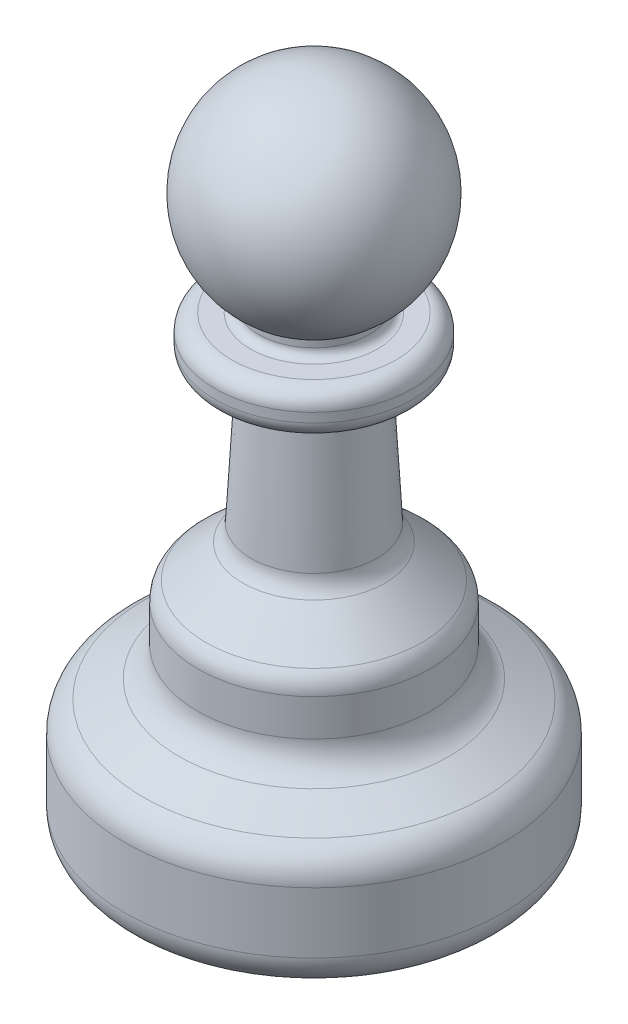
from build123d import *


with BuildPart() as part:
    # Sketch1 → Revolve1 (revolve)
    with BuildSketch(Plane.XY, mode=Mode.PRIVATE) as revolve1_sk:
        with BuildLine():
            Line((2.762352804, 4), (2.762352804, 11.308640554))
            ThreePointArc((2.762352804, 11.308640554), (3.366801674, 13.422932995), (4.997469066, 14.898234597))
            Line((4.997469066, 14.898234597), (9.273425443, 17.000579816))
            ThreePointArc((9.273425443, 17.000579816), (10.904092836, 18.475881418), (11.508541706, 20.590173859))
            Line((11.508541706, 20.590173859), (11.508541706, 24.995826216))
            ThreePointArc((11.508541706, 24.995826216), (11.769262195, 26.219079159), (12.506106881, 27.229714031))
            Line((12.506106881, 27.229714031), (16.936650589, 31.201209356))
            ThreePointArc((16.936650589, 31.201209356), (17.639096171, 32.137552573), (17.929748231, 33.271435192))
            Line((17.929748231, 33.271435192), (18.784598349, 48.917899311))
            ThreePointArc((18.784598349, 48.917899311), (18.512225941, 49.66000185), (17.786087527, 49.972453304))
            Line((17.786087527, 49.972453304), (15.590083244, 49.972453304))
            ThreePointArc((15.590083244, 49.972453304), (14.175869682, 50.558239742), (13.590083244, 51.972453304))
            Line((13.590083244, 51.972453304), (13.590083244, 53.086091554))
            ThreePointArc((13.590083244, 53.086091554), (14.175869682, 54.500305117), (15.590083244, 55.086091554))
            Line((15.590083244, 55.086091554), (17.842214281, 55.086091554))
            ThreePointArc((17.842214281, 55.086091554), (18.549321062, 55.378984773), (18.842214281, 56.086091554))
            Line((18.842214281, 56.086091554), (18.842214281, 56.89908529))
            ThreePointArc((18.842214281, 56.89908529), (13.449850606, 70.945182588), (25.46570334, 80))
            Line((25.46570334, 80), (25.46570334, 0))
            Line((25.46570334, 0), (6.762352804, 0))
            ThreePointArc((6.762352804, 0), (3.933925679, 1.171572875), (2.762352804, 4))
        make_face()
    revolve(revolve1_sk.sketch.rotate(Axis((25.46570334, 0, 0), (0, 1, 0)), 180), axis=Axis((25.46570334, 0, 0), (0, 1, 0)))


solid = part.part
